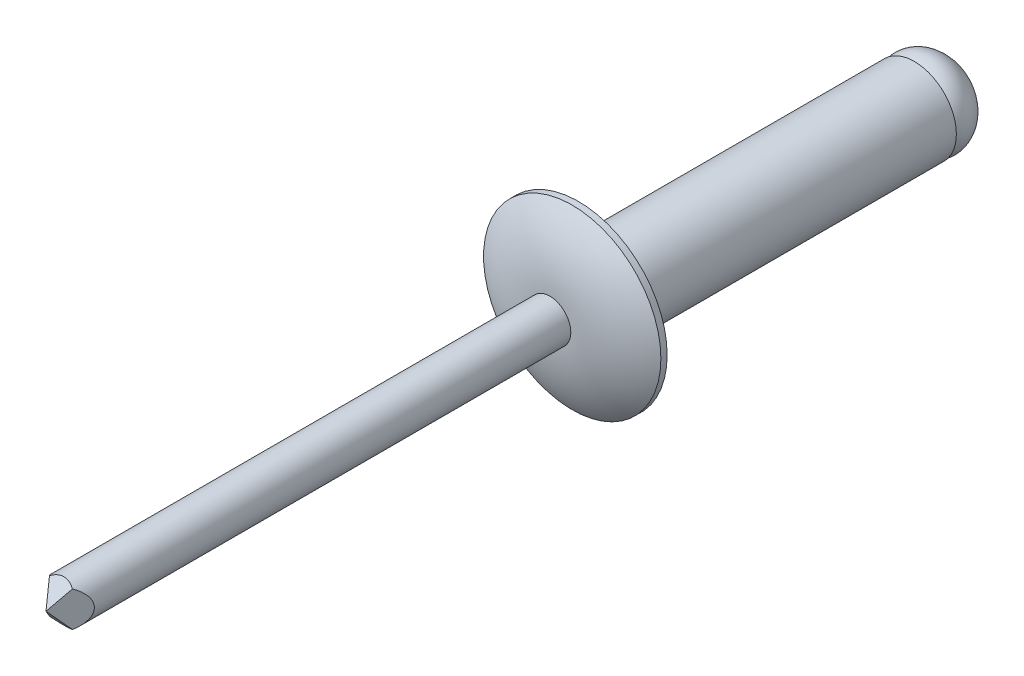
from build123d import *

# Parameters (mm, degrees)
CUT_EXTRUDE1_DEPTH      = 16.51339703
CUT_EXTRUDE1_DEPTH_BACK = 16.51339703
CUT_EXTRUDE2_DEPTH      = 16.51339703
CUT_EXTRUDE2_DEPTH_BACK = 16.51339703


with BuildPart() as part:
    # Sketch2 → Revolve1 (revolve)
    with BuildSketch(Plane(origin=(0, 0, 0), x_dir=(0, 0, -1), z_dir=(1, 0, 0)), mode=Mode.PRIVATE) as revolve1_sk:
        with BuildLine():
            Line((-15.1003, 0), (-15.1003, 0.5953125))
            Line((-15.1003, 0.5953125), (-0.8128, 0.5953125))
            ThreePointArc((-0.8128, 0.5953125), (-0.649928343, 1.606115338), (-0.1778, 2.5146))
            Line((-0.1778, 2.5146), (0, 2.5146))
            Line((0, 2.5146), (0, 1.190625))
            Line((0, 1.190625), (9.525, 1.190625))
            Line((9.525, 1.190625), (9.525, 1.122532015))
            add(Edge.make_bspline(
                [(10.7442, 0), (10.7442, 1.683798023), (9.525, 1.122532015)],
                knots=[1.570796327, 1.570796327, 1.570796327, 3.481429563, 3.481429563, 3.481429563], degree=2, weights=[1, 0.577350269, 1]))
            Line((10.7442, 0), (9.525, 0))
            Line((9.525, 0), (-15.1003, 0))
        make_face()
    revolve(revolve1_sk.sketch.rotate(Axis((0, 0, 15.1003), (0, 0, -1)), 90), axis=Axis((0, 0, 15.1003), (0, 0, -1)))

    # Sketch3 → Cut-Extrude1 (cut, two sides: drawn at the far end of the back side and taken through both)
    with BuildSketch(Plane(origin=(0, 0, 0), x_dir=(1, 0, 0), z_dir=(0, 1, 0)).offset(-CUT_EXTRUDE1_DEPTH_BACK)):
        Polygon((0, -15.1003), (0.7985125, -14.059658249), (0.7985125, -15.6083), (-0.7985125, -15.6083), (-0.7985125, -14.059658249), align=None)
    extrude(amount=CUT_EXTRUDE1_DEPTH + CUT_EXTRUDE1_DEPTH_BACK, mode=Mode.SUBTRACT)

    # Sketch5 → Cut-Extrude2 (cut, two sides: drawn at the far end of the back side and taken through both)
    with BuildSketch(Plane(origin=(0, 0, 0), x_dir=(0, 0, -1), z_dir=(1, 0, 0)).offset(-CUT_EXTRUDE2_DEPTH_BACK)):
        Polygon((-15.1003, 0), (-14.324473645, 0.9128125), (-15.4178, 0.9128125), (-15.4178, -0.9128125), (-14.324473645, -0.9128125), align=None)
    extrude(amount=CUT_EXTRUDE2_DEPTH + CUT_EXTRUDE2_DEPTH_BACK, mode=Mode.SUBTRACT)


solid = part.part
